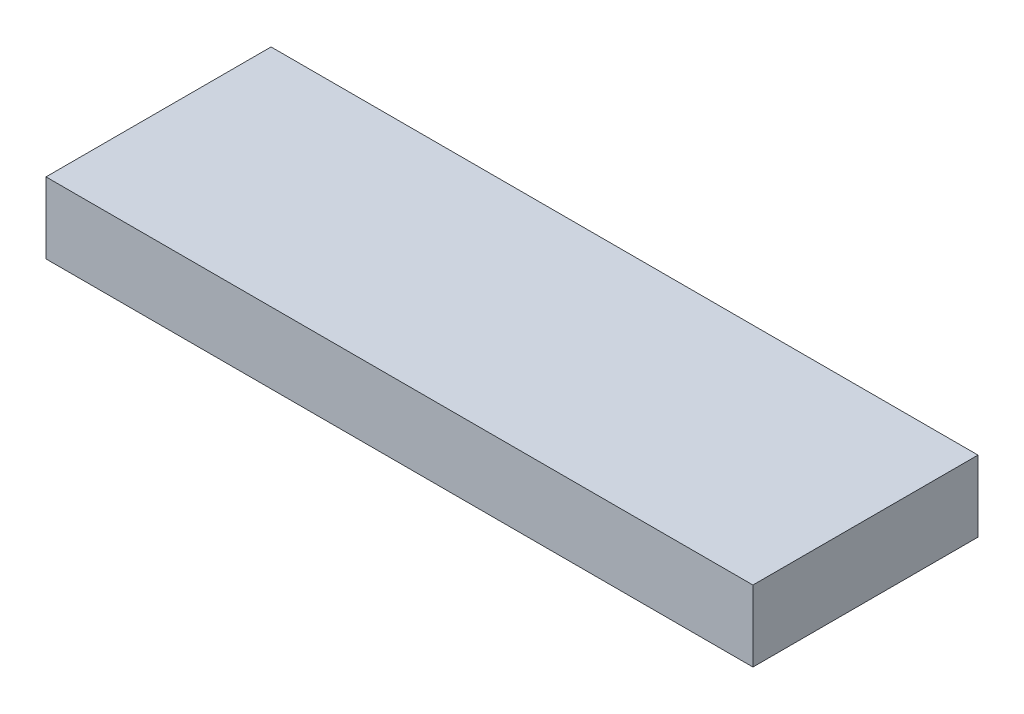
from build123d import *

# Parameters (mm, degrees)
SKETCH1_W           = 189.477532672
SKETCH1_H           = 19.05
BOSS_EXTRUDE1_DEPTH = 60.325


with BuildPart() as part:
    # Sketch1 → Boss-Extrude1 (new body)
    with BuildSketch(Plane.XY):
        with Locations((228.6, -9.525)):
            Rectangle(SKETCH1_W, SKETCH1_H)
    extrude(amount=BOSS_EXTRUDE1_DEPTH)


solid = part.part
